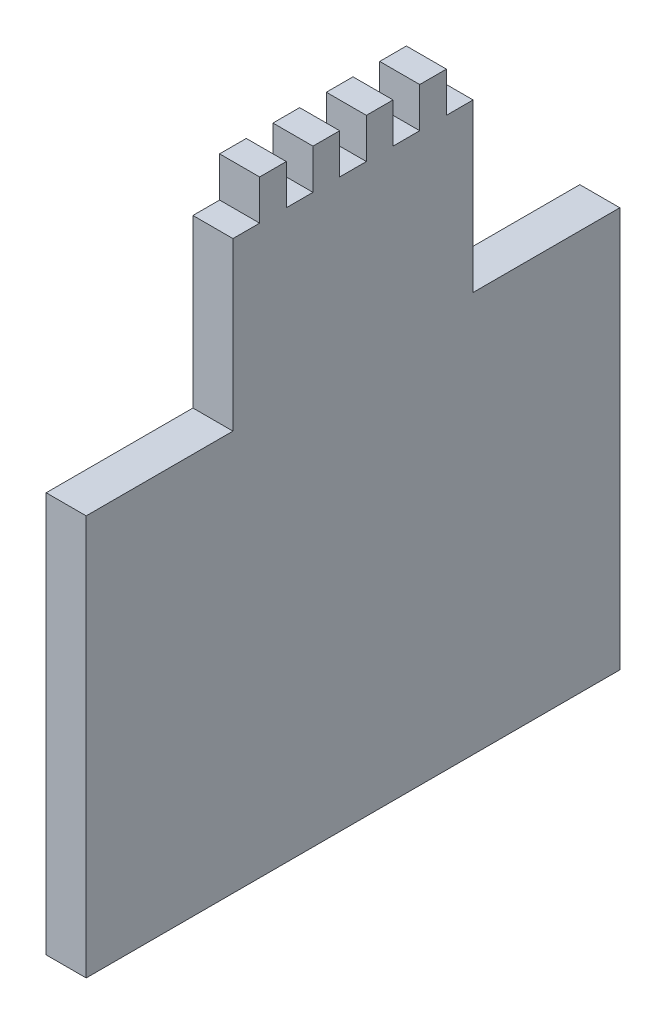
from build123d import *

# Parameters (mm, degrees)
BOSS_EXTRUDE1_DEPTH = 3


with BuildPart() as part:
    # Sketch1 → Boss-Extrude1 (new body)
    with BuildSketch(Plane(origin=(0, 0, 0), x_dir=(0, 0, -1), z_dir=(1, 0, 0))):
        Polygon((-9, 12.5), (-9, 0), (-20, 0), (-20, -30), (20, -30), (20, 0), (9, 0), (9, 12.5), (7, 12.5), (7, 15.5), (5, 15.5), (5, 12.5), (3, 12.5), (3, 15.5), (1, 15.5), (1, 12.5), (-1, 12.5), (-1, 15.5), (-3, 15.5), (-3, 12.5), (-5, 12.5), (-5, 15.5), (-7, 15.5), (-7, 12.5), align=None)
    extrude(amount=BOSS_EXTRUDE1_DEPTH)


solid = part.part
